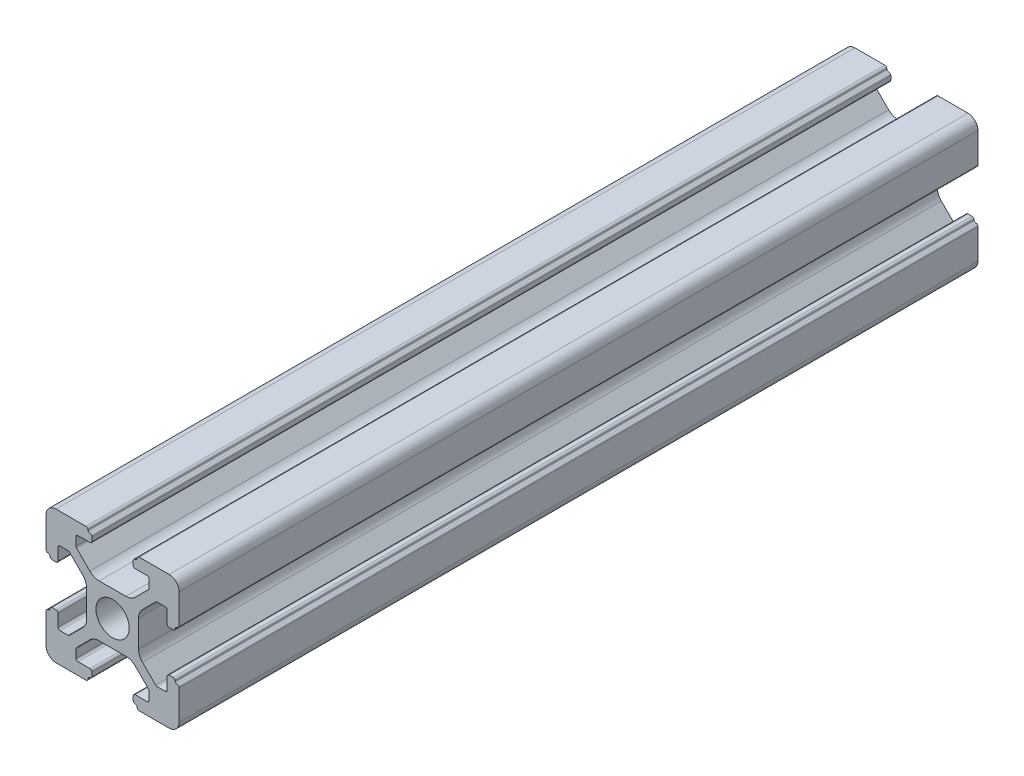
from build123d import *

# Parameters (mm, degrees)
SKETCH_1_R      = 2.5
EXTRUDE_1_DEPTH = 120


with BuildPart() as part:
    # 草图1 → 凸台-拉伸1 (new body)
    with BuildSketch(Plane.XY):
        with BuildLine():
            Line((36.858769875, 17.051935037), (36.858769875, 12.551935037))
            ThreePointArc((36.858769875, 12.551935037), (36.770901909, 12.339803003), (36.558769875, 12.251935037))
            ThreePointArc((36.558769875, 12.251935037), (36.346637841, 12.164067072), (36.258769875, 11.951935037))
            ThreePointArc((36.258769875, 11.951935037), (36.170901909, 11.739803003), (35.958769875, 11.651935037))
            Line((35.958769875, 11.651935037), (35.358769875, 11.651935037))
            ThreePointArc((35.358769875, 11.651935037), (35.146637841, 11.739803003), (35.058769875, 11.951935037))
            Line((35.058769875, 11.951935037), (35.058769875, 13.751935037))
            ThreePointArc((35.058769875, 13.751935037), (34.970901909, 13.964067072), (34.758769875, 14.051935037))
            Line((34.758769875, 14.051935037), (33.543694115, 14.051935037))
            ThreePointArc((33.543694115, 14.051935037), (33.428889086, 14.029098897), (33.331562081, 13.964067072))
            Line((33.331562081, 13.964067072), (31.344556313, 11.977061303))
            ThreePointArc((31.344556313, 11.977061303), (30.91101081, 11.328214606), (30.758769875, 10.562847741))
            Line((30.758769875, 10.562847741), (30.758769875, 6.541022334))
            ThreePointArc((30.758769875, 6.541022334), (30.91101081, 5.775655469), (31.344556313, 5.126808772))
            Line((31.344556313, 5.126808772), (33.331562081, 3.139803003))
            ThreePointArc((33.331562081, 3.139803003), (33.428889086, 3.074771178), (33.543694115, 3.051935037))
            Line((33.543694115, 3.051935037), (34.758769875, 3.051935037))
            ThreePointArc((34.758769875, 3.051935037), (34.970901909, 3.139803003), (35.058769875, 3.351935037))
            Line((35.058769875, 3.351935037), (35.058769875, 5.151935037))
            ThreePointArc((35.058769875, 5.151935037), (35.146637841, 5.364067072), (35.358769875, 5.451935037))
            Line((35.358769875, 5.451935037), (35.958769875, 5.451935037))
            ThreePointArc((35.958769875, 5.451935037), (36.170901909, 5.364067072), (36.258769875, 5.151935037))
            ThreePointArc((36.258769875, 5.151935037), (36.346637841, 4.939803003), (36.558769875, 4.851935037))
            ThreePointArc((36.558769875, 4.851935037), (36.770901909, 4.764067072), (36.858769875, 4.551935037))
            Line((36.858769875, 4.551935037), (36.858769875, 0.051935037))
            ThreePointArc((36.858769875, 0.051935037), (36.419430047, -1.008725134), (35.358769875, -1.448064963))
            Line((35.358769875, -1.448064963), (30.858769875, -1.448064963))
            ThreePointArc((30.858769875, -1.448064963), (30.646637841, -1.360196997), (30.558769875, -1.148064963))
            ThreePointArc((30.558769875, -1.148064963), (30.470901909, -0.935932928), (30.258769875, -0.848064963))
            ThreePointArc((30.258769875, -0.848064963), (30.046637841, -0.760196997), (29.958769875, -0.548064963))
            Line((29.958769875, -0.548064963), (29.958769875, 0.051935037))
            ThreePointArc((29.958769875, 0.051935037), (30.046637841, 0.264067072), (30.258769875, 0.351935037))
            Line((30.258769875, 0.351935037), (32.058769875, 0.351935037))
            ThreePointArc((32.058769875, 0.351935037), (32.270901909, 0.439803003), (32.358769875, 0.651935037))
            Line((32.358769875, 0.651935037), (32.358769875, 1.867010797))
            ThreePointArc((32.358769875, 1.867010797), (32.335933735, 1.981815827), (32.270901909, 2.079142831))
            Line((32.270901909, 2.079142831), (30.283896141, 4.0661486))
            ThreePointArc((30.283896141, 4.0661486), (29.635049443, 4.499694102), (28.869682578, 4.651935037))
            Line((28.869682578, 4.651935037), (24.847857171, 4.651935037))
            ThreePointArc((24.847857171, 4.651935037), (24.082490307, 4.499694102), (23.433643609, 4.0661486))
            Line((23.433643609, 4.0661486), (21.446637841, 2.079142831))
            ThreePointArc((21.446637841, 2.079142831), (21.381606015, 1.981815827), (21.358769875, 1.867010797))
            Line((21.358769875, 1.867010797), (21.358769875, 0.651935037))
            ThreePointArc((21.358769875, 0.651935037), (21.446637841, 0.439803003), (21.658769875, 0.351935037))
            Line((21.658769875, 0.351935037), (23.458769875, 0.351935037))
            ThreePointArc((23.458769875, 0.351935037), (23.670901909, 0.264067072), (23.758769875, 0.051935037))
            Line((23.758769875, 0.051935037), (23.758769875, -0.548064963))
            ThreePointArc((23.758769875, -0.548064963), (23.670901909, -0.760196997), (23.458769875, -0.848064963))
            ThreePointArc((23.458769875, -0.848064963), (23.246637841, -0.935932928), (23.158769875, -1.148064963))
            ThreePointArc((23.158769875, -1.148064963), (23.070901909, -1.360196997), (22.858769875, -1.448064963))
            Line((22.858769875, -1.448064963), (18.358769875, -1.448064963))
            ThreePointArc((18.358769875, -1.448064963), (17.298109703, -1.008725134), (16.858769875, 0.051935037))
            Line((16.858769875, 0.051935037), (16.858769875, 4.551935037))
            ThreePointArc((16.858769875, 4.551935037), (16.946637841, 4.764067072), (17.158769875, 4.851935037))
            ThreePointArc((17.158769875, 4.851935037), (17.370901909, 4.939803003), (17.458769875, 5.151935037))
            ThreePointArc((17.458769875, 5.151935037), (17.546637841, 5.364067072), (17.758769875, 5.451935037))
            Line((17.758769875, 5.451935037), (18.358769875, 5.451935037))
            ThreePointArc((18.358769875, 5.451935037), (18.570901909, 5.364067072), (18.658769875, 5.151935037))
            Line((18.658769875, 5.151935037), (18.658769875, 3.351935037))
            ThreePointArc((18.658769875, 3.351935037), (18.746637841, 3.139803003), (18.958769875, 3.051935037))
            Line((18.958769875, 3.051935037), (20.173845634, 3.051935037))
            ThreePointArc((20.173845634, 3.051935037), (20.288650664, 3.074771178), (20.385977669, 3.139803003))
            Line((20.385977669, 3.139803003), (22.372983437, 5.126808772))
            ThreePointArc((22.372983437, 5.126808772), (22.80652894, 5.775655469), (22.958769875, 6.541022334))
            Line((22.958769875, 6.541022334), (22.958769875, 10.562847741))
            ThreePointArc((22.958769875, 10.562847741), (22.80652894, 11.328214606), (22.372983437, 11.977061303))
            Line((22.372983437, 11.977061303), (20.385977669, 13.964067072))
            ThreePointArc((20.385977669, 13.964067072), (20.288650664, 14.029098897), (20.173845634, 14.051935037))
            Line((20.173845634, 14.051935037), (18.958769875, 14.051935037))
            ThreePointArc((18.958769875, 14.051935037), (18.746637841, 13.964067072), (18.658769875, 13.751935037))
            Line((18.658769875, 13.751935037), (18.658769875, 11.951935037))
            ThreePointArc((18.658769875, 11.951935037), (18.570901909, 11.739803003), (18.358769875, 11.651935037))
            Line((18.358769875, 11.651935037), (17.758769875, 11.651935037))
            ThreePointArc((17.758769875, 11.651935037), (17.546637841, 11.739803003), (17.458769875, 11.951935037))
            ThreePointArc((17.458769875, 11.951935037), (17.370901909, 12.164067072), (17.158769875, 12.251935037))
            ThreePointArc((17.158769875, 12.251935037), (16.946637841, 12.339803003), (16.858769875, 12.551935037))
            Line((16.858769875, 12.551935037), (16.858769875, 17.051935037))
            ThreePointArc((16.858769875, 17.051935037), (17.298109703, 18.112595209), (18.358769875, 18.551935037))
            Line((18.358769875, 18.551935037), (22.858769875, 18.551935037))
            ThreePointArc((22.858769875, 18.551935037), (23.070901909, 18.464067072), (23.158769875, 18.251935037))
            ThreePointArc((23.158769875, 18.251935037), (23.246637841, 18.039803003), (23.458769875, 17.951935037))
            ThreePointArc((23.458769875, 17.951935037), (23.670901909, 17.864067072), (23.758769875, 17.651935037))
            Line((23.758769875, 17.651935037), (23.758769875, 17.051935037))
            ThreePointArc((23.758769875, 17.051935037), (23.670901909, 16.839803003), (23.458769875, 16.751935037))
            Line((23.458769875, 16.751935037), (21.658769875, 16.751935037))
            ThreePointArc((21.658769875, 16.751935037), (21.446637841, 16.664067072), (21.358769875, 16.451935037))
            Line((21.358769875, 16.451935037), (21.358769875, 15.236859278))
            ThreePointArc((21.358769875, 15.236859278), (21.381606015, 15.122054248), (21.446637841, 15.024727244))
            Line((21.446637841, 15.024727244), (23.433643609, 13.037721475))
            ThreePointArc((23.433643609, 13.037721475), (24.082490307, 12.604175972), (24.847857171, 12.451935037))
            Line((24.847857171, 12.451935037), (28.869682578, 12.451935037))
            ThreePointArc((28.869682578, 12.451935037), (29.635049443, 12.604175972), (30.283896141, 13.037721475))
            Line((30.283896141, 13.037721475), (32.270901909, 15.024727244))
            ThreePointArc((32.270901909, 15.024727244), (32.335933735, 15.122054248), (32.358769875, 15.236859278))
            Line((32.358769875, 15.236859278), (32.358769875, 16.451935037))
            ThreePointArc((32.358769875, 16.451935037), (32.270901909, 16.664067072), (32.058769875, 16.751935037))
            Line((32.058769875, 16.751935037), (30.258769875, 16.751935037))
            ThreePointArc((30.258769875, 16.751935037), (30.046637841, 16.839803003), (29.958769875, 17.051935037))
            Line((29.958769875, 17.051935037), (29.958769875, 17.651935037))
            ThreePointArc((29.958769875, 17.651935037), (30.046637841, 17.864067072), (30.258769875, 17.951935037))
            ThreePointArc((30.258769875, 17.951935037), (30.470901909, 18.039803003), (30.558769875, 18.251935037))
            ThreePointArc((30.558769875, 18.251935037), (30.646637841, 18.464067072), (30.858769875, 18.551935037))
            Line((30.858769875, 18.551935037), (35.358769875, 18.551935037))
            ThreePointArc((35.358769875, 18.551935037), (36.419430047, 18.112595209), (36.858769875, 17.051935037))
        make_face()
        with Locations((26.858769875, 8.551935037)):
            Circle(SKETCH_1_R, mode=Mode.SUBTRACT)
    extrude(amount=EXTRUDE_1_DEPTH)


solid = part.part
